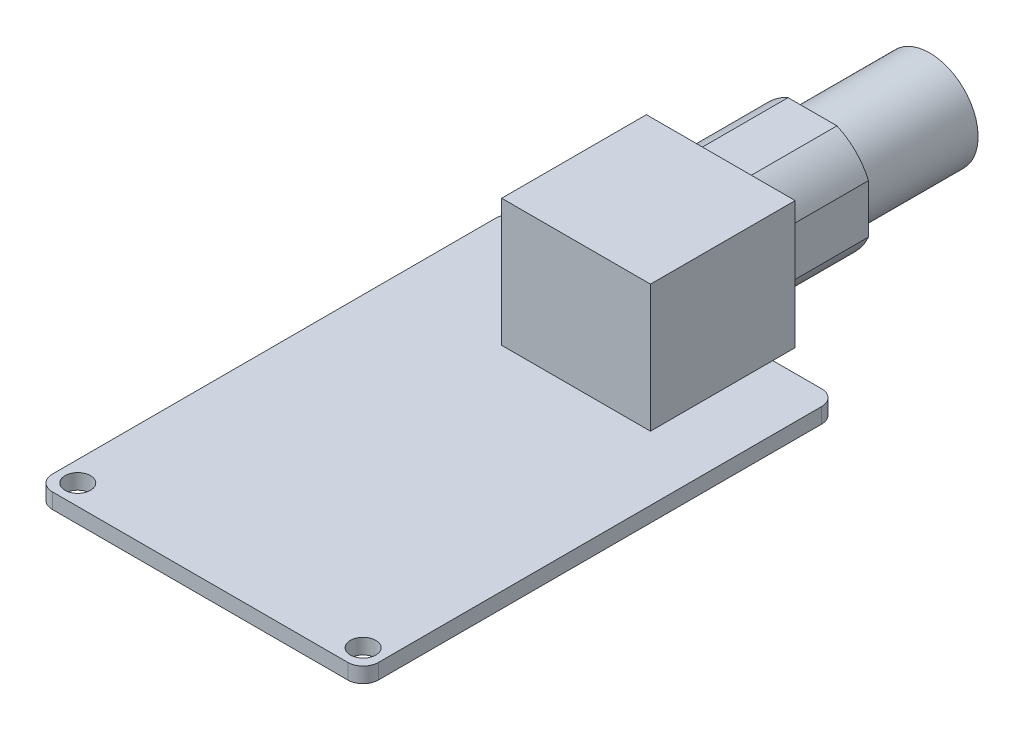
from build123d import *

# Parameters (mm, degrees)
EXTRUDE_1_DEPTH      = 3.5
EXTRUDE_1_DEPTH_BACK = 5.5
SKETCH_1_R           = 6
SKETCH_2_R           = 4.75
EXTRUDE_2_DEPTH      = 11.5
SKETCH_3_R           = 4.25
CUT_EXTRUDE_1_DEPTH  = 11.5
SKETCH_4_W           = 14.6
SKETCH_4_H           = 12.5
EXTRUDE_3_DEPTH      = 14.2
SKETCH_5_R           = 1.25
EXTRUDE_4_DEPTH      = 1.5
CUT_EXTRUDE_2_DEPTH  = 9


with BuildPart() as part:
    # 草圖1 → 填料-伸長1 (new, two sides: drawn at the far end of the back side and taken through both)
    with BuildSketch(Plane.XY.offset(-EXTRUDE_1_DEPTH_BACK)):
        with Locations((-29.340909091, 31.5)):
            Circle(SKETCH_1_R)
    extrude(amount=EXTRUDE_1_DEPTH + EXTRUDE_1_DEPTH_BACK)

    # 草圖2 → 填料-伸長2 (add)
    with BuildSketch(Plane(origin=(0, 0, -5.5), x_dir=(-1, 0, 0), z_dir=(0, 0, -1))):
        with Locations((29.340909091, 31.5)):
            Circle(SKETCH_2_R)
    extrude(amount=EXTRUDE_2_DEPTH)

    # 草圖3 → 除料-伸長1 (cut)
    with BuildSketch(Plane(origin=(0, 0, -17), x_dir=(-1, 0, 0), z_dir=(0, 0, -1))):
        with Locations((29.340909091, 31.5)):
            Circle(SKETCH_3_R)
    extrude(amount=-CUT_EXTRUDE_1_DEPTH, mode=Mode.SUBTRACT)

    # 草圖4 → 填料-伸長3 (add)
    with BuildSketch(Plane.XY.offset(3.5)):
        with Locations((-29.340909091, 31.35)):
            Rectangle(SKETCH_4_W, SKETCH_4_H)
    extrude(amount=EXTRUDE_3_DEPTH)

    # 草圖5 → 填料-伸長4 (add)
    with BuildSketch(Plane.XZ.offset(-25.1)):
        with BuildLine():
            Line((-17.240909091, 5.697422491), (-46.240909091, 5.697422491))
            ThreePointArc((-46.240909091, 5.697422491), (-47.301569263, 6.136762319), (-47.740909091, 7.197422491))
            Line((-47.740909091, 7.197422491), (-47.740909091, 50.697422491))
            ThreePointArc((-47.740909091, 50.697422491), (-47.301569263, 51.758082663), (-46.240909091, 52.197422491))
            Line((-46.240909091, 52.197422491), (-17.240909091, 52.197422491))
            ThreePointArc((-17.240909091, 52.197422491), (-16.180248919, 51.758082663), (-15.740909091, 50.697422491))
            Line((-15.740909091, 50.697422491), (-15.740909091, 7.197422491))
            ThreePointArc((-15.740909091, 7.197422491), (-16.180248919, 6.136762319), (-17.240909091, 5.697422491))
        make_face()
        with Locations(Location((-17.740909091, 50.197422491, 0), (0, 0, 270))):
            Circle(SKETCH_5_R, mode=Mode.SUBTRACT)
        with Locations(Location((-45.740909091, 50.197422491, 0), (0, 0, 270))):
            Circle(SKETCH_5_R, mode=Mode.SUBTRACT)
    extrude(amount=EXTRUDE_4_DEPTH)

    # 草圖6 → 除料-伸長2 (cut)
    with BuildSketch(Plane(origin=(0, 0, -5.5), x_dir=(-1, 0, 0), z_dir=(0, 0, -1))):
        with BuildLine():
            Line((26.942993329, 26), (31.738824853, 26))
            ThreePointArc((31.738824853, 26), (29.340909091, 25.5), (26.942993329, 26))
        make_face()
        with BuildLine():
            Line((23.840909091, 29.102084238), (23.840909091, 33.897915762))
            ThreePointArc((23.840909091, 33.897915762), (23.340909091, 31.5), (23.840909091, 29.102084238))
        make_face()
        with BuildLine():
            Line((26.942993329, 37), (31.738824853, 37))
            ThreePointArc((31.738824853, 37), (29.340909091, 37.5), (26.942993329, 37))
        make_face()
        with BuildLine():
            Line((34.840909091, 29.102084238), (34.840909091, 33.897915762))
            ThreePointArc((34.840909091, 33.897915762), (35.340909091, 31.5), (34.840909091, 29.102084238))
        make_face()
    extrude(amount=-CUT_EXTRUDE_2_DEPTH, mode=Mode.SUBTRACT)


solid = part.part
